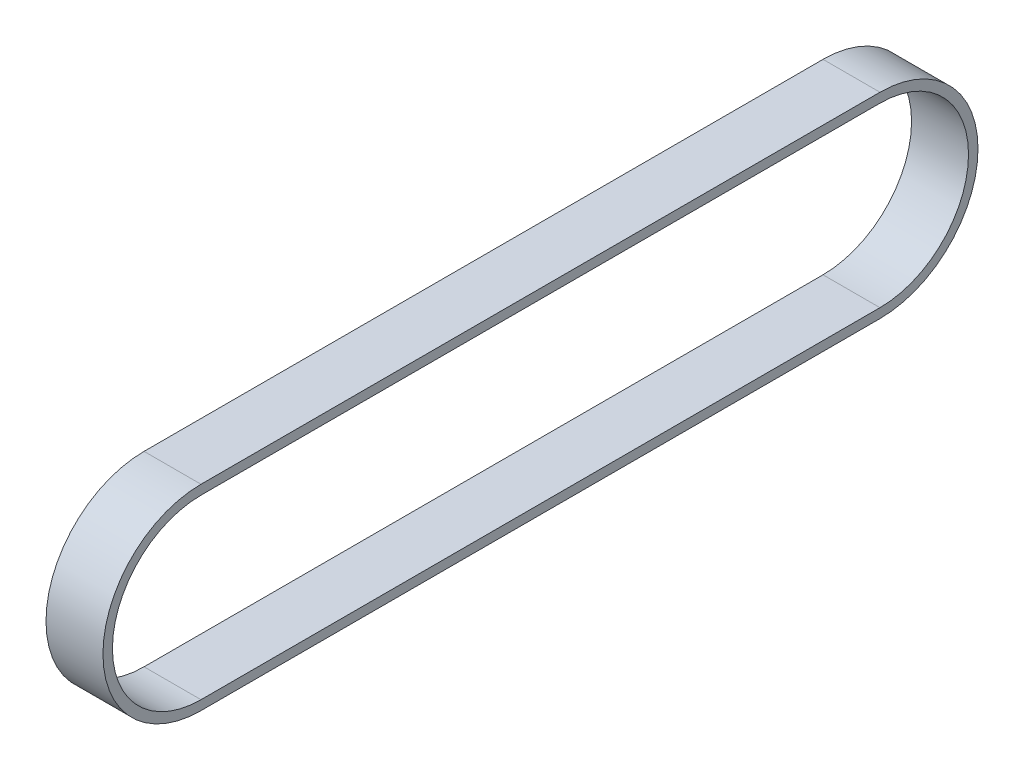
from build123d import *

# Parameters (mm, degrees)
EXTRUDE_THIN1_DEPTH = 3


with BuildPart() as part:
    # Sketch1 → Extrude-Thin1 (new, symmetric)
    with BuildSketch(Plane(origin=(0, 0, 0), x_dir=(0, 0, -1), z_dir=(1, 0, 0))):
        with BuildLine():
            Line((-71.545, 10.33), (0, 10.33))
            ThreePointArc((0, 10.33), (10.33, 0), (0, -10.33))
            Line((0, -10.33), (-71.545, -10.33))
            ThreePointArc((-71.545, -10.33), (-81.875, 0), (-71.545, 10.33))
        make_face()
        with BuildLine():
            Line((-71.545, 9.33), (0, 9.33))
            ThreePointArc((0, 9.33), (9.33, 0), (0, -9.33))
            Line((0, -9.33), (-71.545, -9.33))
            ThreePointArc((-71.545, -9.33), (-80.875, 0), (-71.545, 9.33))
        make_face(mode=Mode.SUBTRACT)
    extrude(amount=EXTRUDE_THIN1_DEPTH, both=True)


solid = part.part
